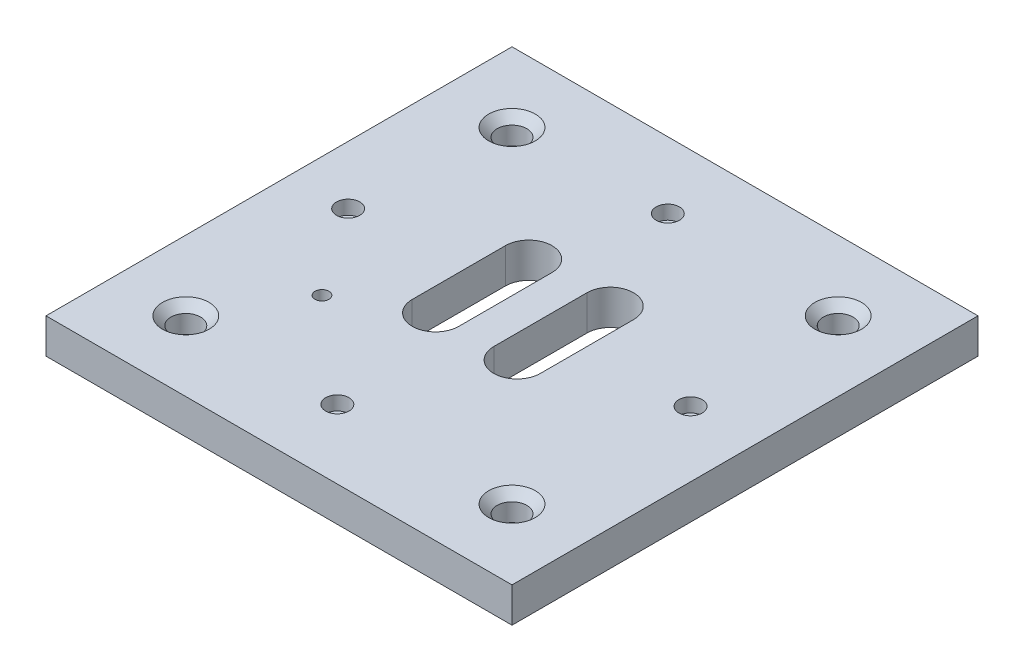
from build123d import *

# Parameters (mm, degrees)
IZIM1_W                          = 400
IZIM1_H                          = 400
Y_KSEKLIK_EKSTR_ZYON1_DEPTH      = 30
F_25_5_25_5_AP_DELIK1_AT_2_COUNT = 2
F_25_5_25_5_AP_DELIK1_AT_2_PITCH = 280
F_25_5_25_5_AP_DELIK1_AT_3_COUNT = 2
F_25_5_25_5_AP_DELIK1_AT_3_PITCH = 280
F_25_5_25_5_AP_DELIK1_AT_4_COUNT = 2
F_25_5_25_5_AP_DELIK1_AT_4_PITCH = 395.979797464
KES_EKSTR_ZYON3_DEPTH            = 30
M12_SHCS_IN_HAV_A1_D             = 13
M12_SHCS_IN_HAV_A1_CBORE_D       = 20
M12_SHCS_IN_HAV_A1_CBORE_DEPTH   = 12
M14X2_0_DI_LI_DELIK1_D           = 12
M14X2_0_DI_LI_DELIK1_DEPTH       = 20
M14X2_0_DI_LI_DELIK1_TIP         = 3.605163714


with BuildPart() as part:
    # Çizim1 → Yükseklik-Ekstrüzyon1 (new body)
    with BuildSketch(Plane(origin=(0, 0, 0), x_dir=(1, 0, 0), z_dir=(0, 1, 0))):
        Rectangle(IZIM1_W, IZIM1_H)
    extrude(amount=Y_KSEKLIK_EKSTR_ZYON1_DEPTH)

    # Çizim3 → Ø25.5 (25.5) Çap Delik1 (revolve, cut)
    with BuildSketch(Plane(origin=(-140, 30, 140), x_dir=(0, 0, 1), z_dir=(1, 0, 0))):
        Polygon((0, 0), (0, 30), (20, 30), (12.75, 22.75), (12.75, 7.25), (20, 0), align=None)
    f_25_5_25_5_ap_delik1 = revolve(axis=Axis((-140, 36.35, 140), (0, -1, 0)), mode=Mode.SUBTRACT)

    # Ø25.5 (25.5) Çap Delik1 at 2: Ø25.5 (25.5) Çap Delik1 ×2
    with Locations(*[(0, 0, -i * F_25_5_25_5_AP_DELIK1_AT_2_PITCH) for i in range(1, F_25_5_25_5_AP_DELIK1_AT_2_COUNT)]):
        add(f_25_5_25_5_ap_delik1, mode=Mode.SUBTRACT)

    # Ø25.5 (25.5) Çap Delik1 at 3: Ø25.5 (25.5) Çap Delik1 ×2
    with Locations(*[(i * F_25_5_25_5_AP_DELIK1_AT_3_PITCH, 0, 0) for i in range(1, F_25_5_25_5_AP_DELIK1_AT_3_COUNT)]):
        add(f_25_5_25_5_ap_delik1, mode=Mode.SUBTRACT)

    # Ø25.5 (25.5) Çap Delik1 at 4: Ø25.5 (25.5) Çap Delik1 ×2
    with Locations(*[Vector(0.7071067811865476, 0, -0.7071067811865476) * (i * F_25_5_25_5_AP_DELIK1_AT_4_PITCH) for i in range(1, F_25_5_25_5_AP_DELIK1_AT_4_COUNT)]):
        add(f_25_5_25_5_ap_delik1, mode=Mode.SUBTRACT)

    # Çizim4 → Kes-Ekstrüzyon3 (cut)
    with BuildSketch(Plane(origin=(0, 30, 0), x_dir=(1, 0, 0), z_dir=(0, 1, 0))):
        with BuildLine():
            Line((-15, 49.352110618), (-15, -30.647889382))
            ThreePointArc((-15, -30.647889382), (-35, -50.647889382), (-55, -30.647889382))
            Line((-55, -30.647889382), (-55, 49.352110618))
            ThreePointArc((-55, 49.352110618), (-35, 69.352110618), (-15, 49.352110618))
        make_face()
        with BuildLine():
            Line((55, 49.352110618), (55, -30.647889382))
            ThreePointArc((55, -30.647889382), (35, -50.647889382), (15, -30.647889382))
            Line((15, -30.647889382), (15, 49.352110618))
            ThreePointArc((15, 49.352110618), (35, 69.352110618), (55, 49.352110618))
        make_face()
    extrude(amount=-KES_EKSTR_ZYON3_DEPTH, mode=Mode.SUBTRACT)

    # M12 SHCS İçin Havşa1 (through all)
    with Locations(Plane(origin=(0, 30, 0), x_dir=(1, 0, 0), z_dir=(0, 1, 0))):
        with Locations((-9.135973947, -140.778837954), (-149.99326257, 9.352110618), (-9.135973947, 142.861352041), (143.896335676, 9.352110618)):
            CounterBoreHole(M12_SHCS_IN_HAV_A1_D / 2, M12_SHCS_IN_HAV_A1_CBORE_D / 2, M12_SHCS_IN_HAV_A1_CBORE_DEPTH)

    # M14x2.0 Dişli Delik1
    with Locations(Plane(origin=(0, 30, 0), x_dir=(1, 0, 0), z_dir=(0, 1, 0))):
        with Locations((-96.821851103, -66.289960557)):
            Hole(M14X2_0_DI_LI_DELIK1_D / 2, depth=M14X2_0_DI_LI_DELIK1_DEPTH)
            with Locations((0, 0, -(M14X2_0_DI_LI_DELIK1_DEPTH + M14X2_0_DI_LI_DELIK1_TIP / 2))):  # 118° drill point
                Cone(0, M14X2_0_DI_LI_DELIK1_D / 2, M14X2_0_DI_LI_DELIK1_TIP, mode=Mode.SUBTRACT)


solid = part.part
